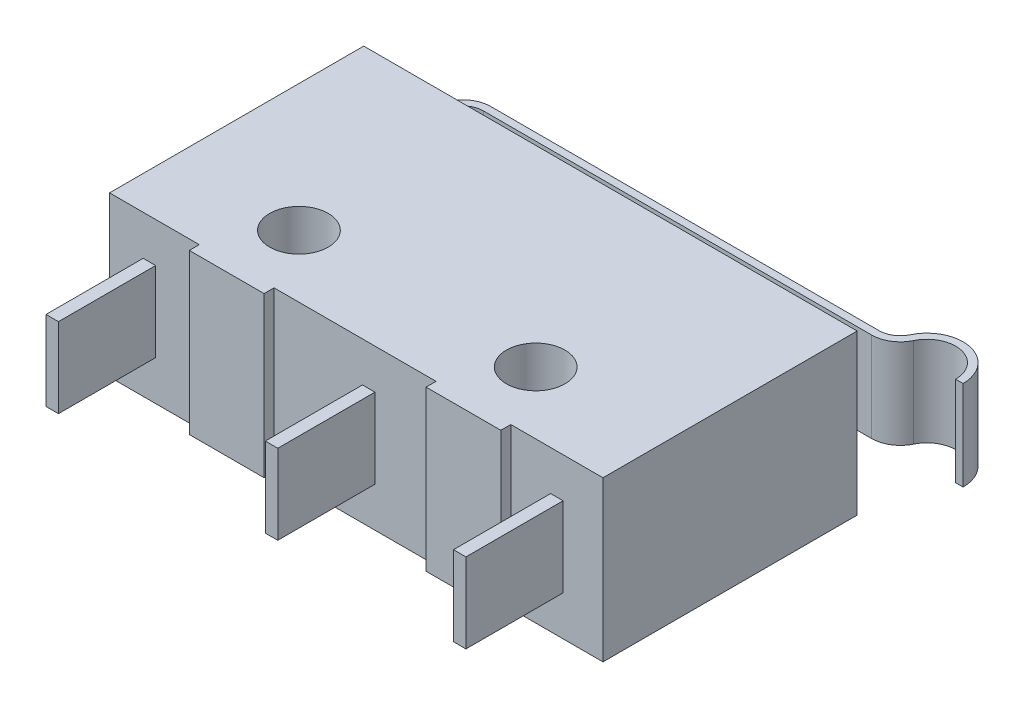
from build123d import *

# Parameters (mm, degrees)
SKETCH_1_W             = 19.8
SKETCH_1_H             = 10.2
EXTRUDE_1_DEPTH        = 6.4
CUT_EXTRUDE_1_REACH    = 25.174
SKETCH_2_R             = 1.175
EXTRUDE_1_2_DEPTH      = 1.8
EXTRUDE_1_2_DEPTH_BACK = 1.8
EXTRUDE_2_DEPTH        = 1.6
EXTRUDE_2_DEPTH_BACK   = 1.6
SKETCH_4_W             = 0.5
SKETCH_4_H             = 3.9
SKETCH_5_W             = 3
SKETCH_5_H             = 0.4
EXTRUDE_2_2_DEPTH      = 6.4


with BuildPart() as part:
    # 草图1 → Extrude 1 (new body)
    with BuildSketch(Plane(origin=(0, 0, 0), x_dir=(1, 0, 0), z_dir=(0, 1, 0))):
        with Locations((9.9, 5.1)):
            Rectangle(SKETCH_1_W, SKETCH_1_H)
    extrude(amount=EXTRUDE_1_DEPTH)

    # 草图2 → 切除-拉伸1 (cut, up to next)
    with BuildSketch(Plane(origin=(0, 6.4, 0), x_dir=(1, 0, 0), z_dir=(0, 1, 0)), mode=Mode.PRIVATE) as cut_extrude_1_sk1:
        with Locations(Location((5.1, 2.5, 0), (0, 0, 270))):
            Circle(SKETCH_2_R)
    cut_extrude_1_tool1 = extrude(cut_extrude_1_sk1.sketch, amount=-CUT_EXTRUDE_1_REACH, mode=Mode.PRIVATE) & part.part
    # 草图2 → 切除-拉伸1 (cut, up to next)
    with BuildSketch(Plane(origin=(0, 6.4, 0), x_dir=(1, 0, 0), z_dir=(0, 1, 0)), mode=Mode.PRIVATE) as cut_extrude_1_sk2:
        with Locations(Location((14.6, 2.5, 0), (0, 0, 270))):
            Circle(SKETCH_2_R)
    cut_extrude_1_tool2 = extrude(cut_extrude_1_sk2.sketch, amount=-CUT_EXTRUDE_1_REACH, mode=Mode.PRIVATE) & part.part
    add(cut_extrude_1_tool1.solids().sort_by_distance((5.1, 6.4, -2.5))[0], mode=Mode.SUBTRACT)
    add(cut_extrude_1_tool2.solids().sort_by_distance((14.6, 6.4, -2.5))[0], mode=Mode.SUBTRACT)

    # 草图3 → Extrude 1 2 (add, two sides: drawn at the far end of the back side and taken through both)
    with BuildSketch(Plane(origin=(0, 3.2, 0), x_dir=(1, 0, 0), z_dir=(0, 1, 0)).offset(-EXTRUDE_1_2_DEPTH_BACK)):
        with BuildLine():
            Line((2.403782047, 10.2), (2.403782047, 10.9))
            ThreePointArc((2.403782047, 10.9), (2.652741283, 11.501040764), (3.253782047, 11.75))
            Line((3.253782047, 11.75), (18.828768482, 11.75))
            ThreePointArc((18.828768482, 11.75), (19.440119445, 11.925962013), (19.864384241, 12.4))
            ThreePointArc((19.864384241, 12.4), (21.156458454, 13.021039277), (22.05, 11.9))
            Line((22.05, 11.9), (22.35, 11.9))
            ThreePointArc((22.35, 11.9), (21.223360659, 13.313484306), (19.594223608, 12.530434783))
            ThreePointArc((19.594223608, 12.530434783), (19.280636585, 12.180058879), (18.828768482, 12.05))
            Line((18.828768482, 12.05), (3.253782047, 12.05))
            ThreePointArc((3.253782047, 12.05), (2.440609249, 11.713172798), (2.103782047, 10.9))
            Line((2.103782047, 10.9), (2.103782047, 10.2))
            Line((2.103782047, 10.2), (2.403782047, 10.2))
        make_face()
    extrude(amount=EXTRUDE_1_2_DEPTH + EXTRUDE_1_2_DEPTH_BACK)

    # 草图4 → Extrude 2 (add, two sides: drawn at the far end of the back side and taken through both)
    with BuildSketch(Plane(origin=(0, 3.2, 0), x_dir=(1, 0, 0), z_dir=(0, 1, 0)).offset(-EXTRUDE_2_DEPTH_BACK)):
        with Locations((1.6, -1.95)):
            Rectangle(SKETCH_4_W, SKETCH_4_H)
        with Locations((10.4, -1.95)):
            Rectangle(SKETCH_4_W, SKETCH_4_H)
        with Locations((17.95, -1.95)):
            Rectangle(SKETCH_4_W, SKETCH_4_H)
    extrude(amount=EXTRUDE_2_DEPTH + EXTRUDE_2_DEPTH_BACK)

    # 草图5 → Extrude 2 2 (add)
    with BuildSketch(Plane(origin=(0, 6.4, 0), x_dir=(1, 0, 0), z_dir=(0, 1, 0))):
        with Locations((5.1, -0.2)):
            Rectangle(SKETCH_5_W, SKETCH_5_H)
        with Locations((14.6, -0.2)):
            Rectangle(SKETCH_5_W, SKETCH_5_H)
    extrude(amount=-EXTRUDE_2_2_DEPTH)


solid = part.part
